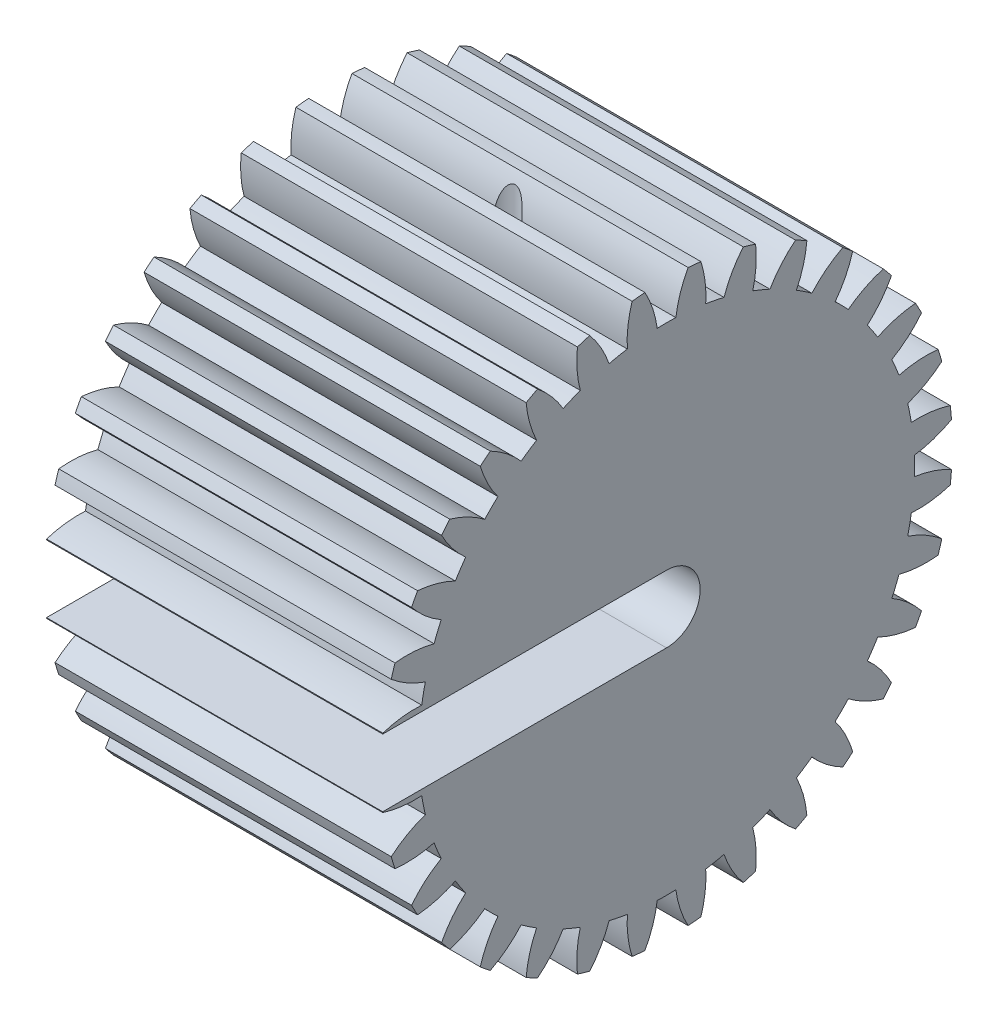
from build123d import *

# Parameters (mm, degrees)
BASPROSKE_W             = 10
BASPROSKE_H             = 8.5
TOOTHCUT_DEPTH          = 16.636495771
TEETHCUTS_COUNT         = 32
TEETHCUTS_ANGLE         = 348.75
BORSKE_R                = 1
BORE_DEPTH              = 50.0000508
SKETCH1_W               = 10
SKETCH1_H               = 2
CUT_EXTRUDE1_DEPTH      = 16.610070769
CUT_EXTRUDE2_DEPTH      = 17.174846825
CUT_EXTRUDE2_DEPTH_BACK = 17.174846825
SKETCH2_R               = 0.5


with BuildPart() as part:
    # BasProSke → Base-Revolve (revolve)
    with BuildSketch(Plane(origin=(0, 0, 0), x_dir=(1, 0, 0), z_dir=(0, 1, 0)), mode=Mode.PRIVATE) as base_revolve_sk:
        with Locations((5, 4.25)):
            Rectangle(BASPROSKE_W, BASPROSKE_H)
    revolve(base_revolve_sk.sketch.rotate(Axis((-10, 0, 0), (1, 0, 0)), 180), axis=Axis((-10, 0, 0), (1, 0, 0)))

    # TooCutSke → ToothCut (cut, through all)
    with BuildSketch(Plane(origin=(0, 0, 0), x_dir=(0, 0, -1), z_dir=(1, 0, 0))):
        with BuildLine():
            ThreePointArc((0.277002447, 7.3687954), (0, 7.374), (-0.277002447, 7.3687954))
            ThreePointArc((-0.277002447, 7.3687954), (-0.41335061, 7.952280695), (-0.656086882, 8.500117362))
            ThreePointArc((-0.656086882, 8.500117362), (0, 8.5254), (0.656086882, 8.500117362))
            ThreePointArc((0.656086882, 8.500117362), (0.41335061, 7.952280695), (0.277002447, 7.3687954))
        make_face()
    toothcut = extrude(amount=TOOTHCUT_DEPTH, mode=Mode.SUBTRACT)

    # TeethCuts: ToothCut ×32 about axis
    teethcuts_axis = Axis((-10, 0, 0), (1, 0, 0))
    for i in range(1, TEETHCUTS_COUNT):
        add(toothcut.rotate(teethcuts_axis, i * TEETHCUTS_ANGLE / (TEETHCUTS_COUNT - 1)), mode=Mode.SUBTRACT)

    # BorSke → Bore (cut, symmetric)
    with BuildSketch(Plane(origin=(0, 0, 0), x_dir=(0, 0, -1), z_dir=(1, 0, 0))):
        with Locations(Location((0, 0, 0), (0, 0, 180))):
            Circle(BORSKE_R)
    extrude(amount=BORE_DEPTH, both=True, mode=Mode.SUBTRACT)

    # Sketch1 → Cut-Extrude1 (cut, through all)
    with BuildSketch(Plane(origin=(10, 0, 0), x_dir=(0, 0, -1), z_dir=(1, 0, 0))):
        with Locations((-5, 0)):
            Rectangle(SKETCH1_W, SKETCH1_H)
    extrude(amount=-CUT_EXTRUDE1_DEPTH, mode=Mode.SUBTRACT)

    # Sketch2 → Cut-Extrude2 (cut, two sides: drawn at the far end of the back side and taken through both)
    with BuildSketch(Plane.XZ.offset(-1).offset(-CUT_EXTRUDE2_DEPTH_BACK)):
        with Locations(Location((5, 0, 0), (0, 0, 326.357798302))):
            Circle(SKETCH2_R)
    extrude(amount=CUT_EXTRUDE2_DEPTH + CUT_EXTRUDE2_DEPTH_BACK, mode=Mode.SUBTRACT)


solid = part.part
